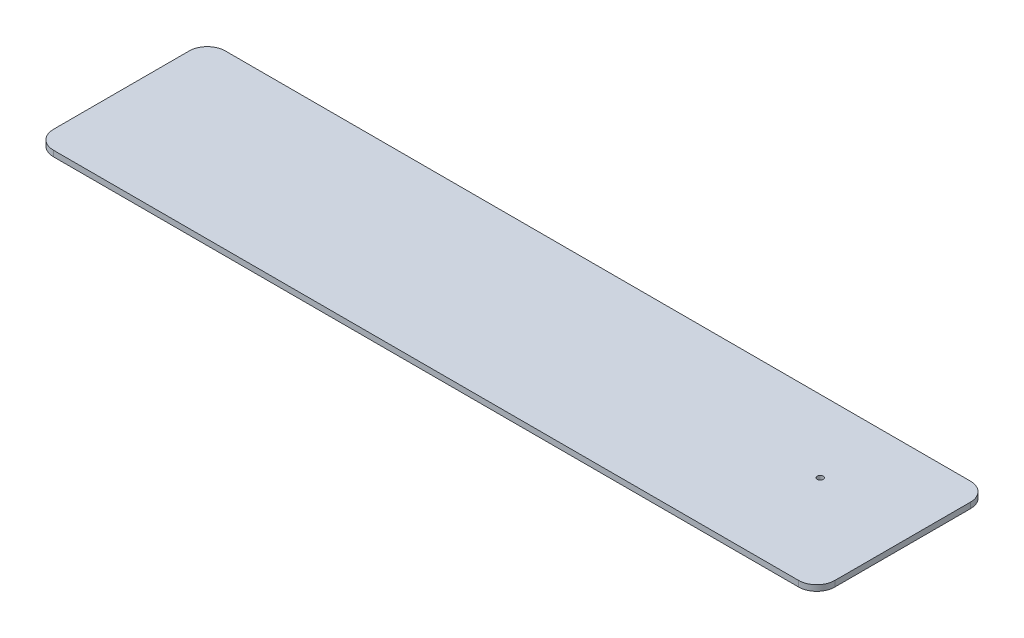
from build123d import *

# Parameters (mm, degrees)
SKETCH1_W           = 431.8
SKETCH1_H           = 95
SKETCH1_R           = 1.65
BOSS_EXTRUDE1_DEPTH = 3.175
FILLET1_R           = 10


with BuildPart() as part:
    # Sketch1 → Boss-Extrude1 (new body)
    with BuildSketch(Plane(origin=(0, 0, 0), x_dir=(1, 0, 0), z_dir=(0, 1, 0))):
        with Locations((213.767466267, 47.5)):
            Rectangle(SKETCH1_W, SKETCH1_H)
        with Locations(Location((376.491467747, 55.116720807, 0), (0, 0, 270))):
            Circle(SKETCH1_R, mode=Mode.SUBTRACT)
    extrude(amount=BOSS_EXTRUDE1_DEPTH)

    # Fillet1
    fillet1_edges = [part.edges().sort_by_distance(p)[0] for p in [
        (-2.132533733, 1.5875, -95),
        (429.667466267, 1.5875, -95),
        (429.667466267, 1.5875, 0),
        (-2.132533733, 1.5875, 0),
    ]]
    fillet(fillet1_edges, radius=FILLET1_R)


solid = part.part
